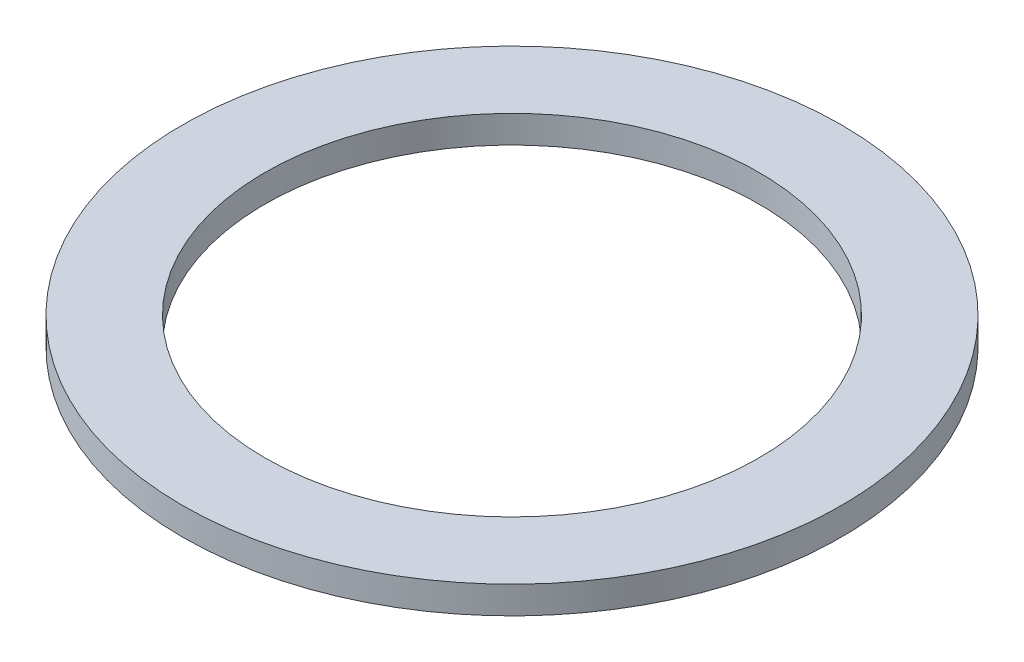
from build123d import *

# Parameters (mm, degrees)
ESQUISSE1_R        = 24
ESQUISSE1_R_2      = 18
BOSS_EXTRU_1_DEPTH = 2


with BuildPart() as part:
    # Esquisse1 → Boss.-Extru.1 (new body)
    with BuildSketch(Plane(origin=(0, 0, 0), x_dir=(1, 0, 0), z_dir=(0, 1, 0))):
        with Locations(Location((0, 0, 0), (0, 0, 270))):
            Circle(ESQUISSE1_R)
        with Locations(Location((0, 0, 0), (0, 0, 270))):
            Circle(ESQUISSE1_R_2, mode=Mode.SUBTRACT)
    extrude(amount=BOSS_EXTRU_1_DEPTH)


solid = part.part
